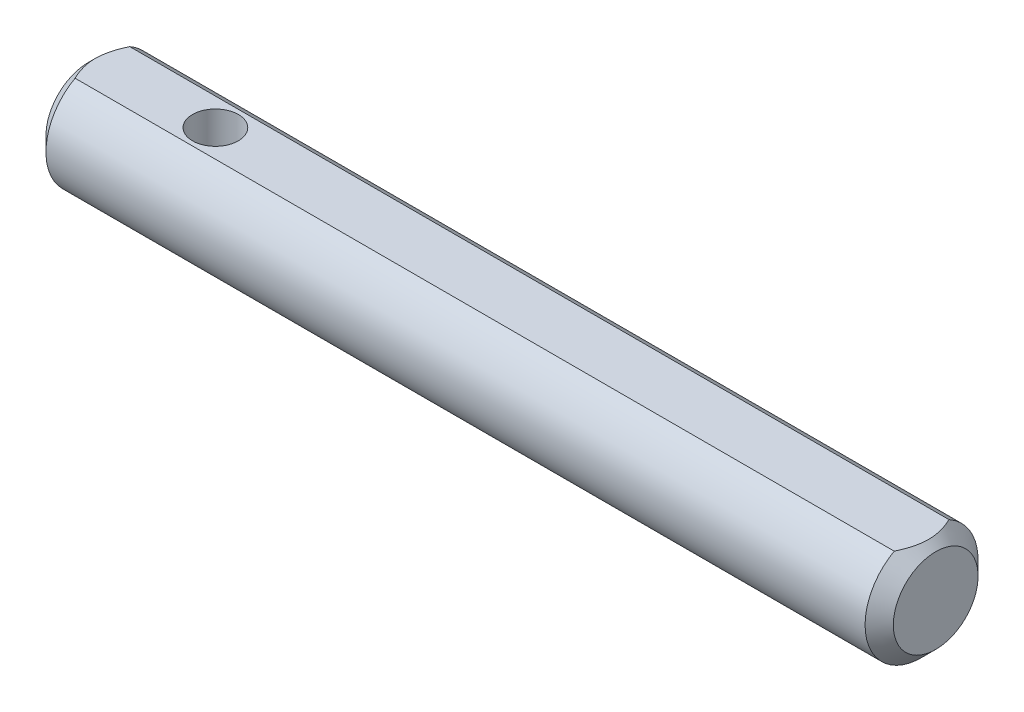
from build123d import *

# Parameters (mm, degrees)
SKETCH1_W          = 60
SKETCH1_H          = 4
CHAMFER1_SIZE      = 1
CUT_EXTRUDE1_DEPTH = 61.266076693
TAP1_D             = 3.242


with BuildPart() as part:
    # Sketch1 → Revolve1 (revolve)
    with BuildSketch(Plane.XY, mode=Mode.PRIVATE) as revolve1_sk:
        with Locations((30, 2)):
            Rectangle(SKETCH1_W, SKETCH1_H)
    revolve(revolve1_sk.sketch.rotate(Axis((0, 0, 0), (1, 0, 0)), 90), axis=Axis((0, 0, 0), (1, 0, 0)))

    # Chamfer1
    chamfer1_edges = [part.edges().sort_by_distance(p)[0] for p in [
        (60, 0, -4),
        (0, 0, -4),
    ]]
    chamfer(chamfer1_edges, length=CHAMFER1_SIZE)

    # Sketch2 → Cut-Extrude1 (cut, through all)
    with BuildSketch(Plane(origin=(0, 0, 0), x_dir=(0, 0, -1), z_dir=(1, 0, 0))):
        with BuildLine():
            Line((-1.936491673, 3.5), (1.936491673, 3.5))
            ThreePointArc((1.936491673, 3.5), (0, 4), (-1.936491673, 3.5))
        make_face()
    extrude(amount=CUT_EXTRUDE1_DEPTH, mode=Mode.SUBTRACT)

    # Tap1 (through all)
    with Locations(Plane(origin=(0, 3.5, 0), x_dir=(1, 0, 0), z_dir=(0, 1, 0))):
        with Locations((9, 0)):
            Hole(TAP1_D / 2)


solid = part.part
